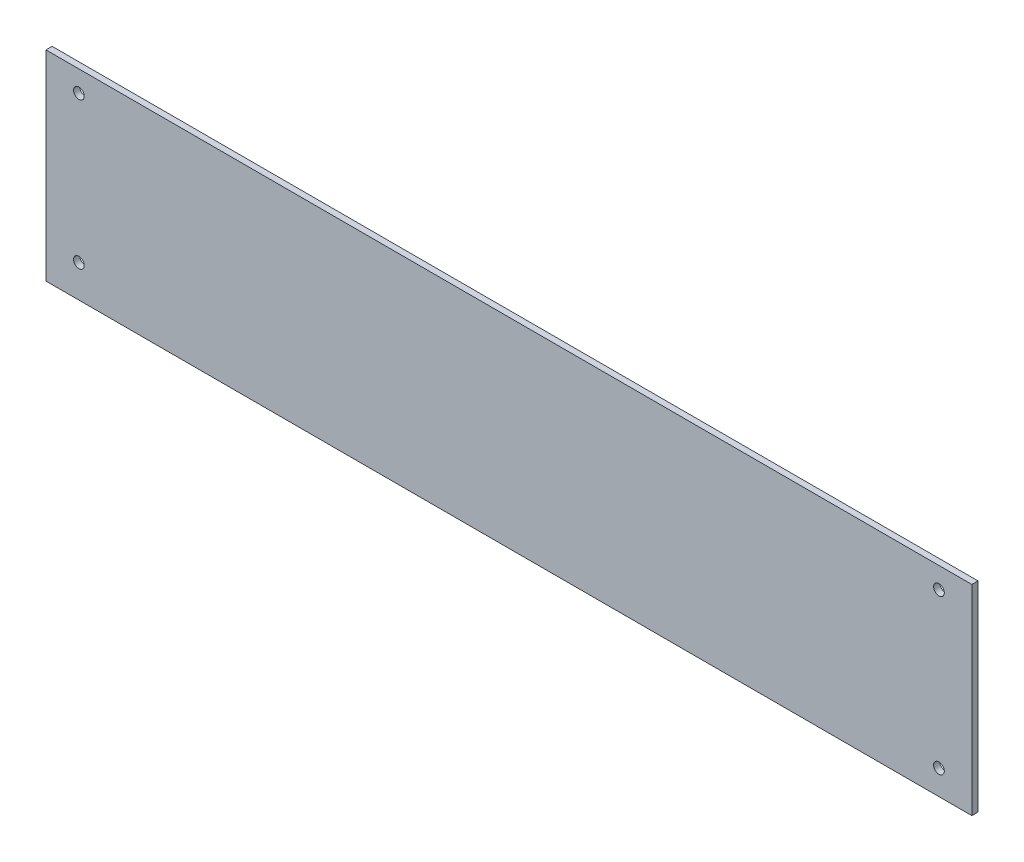
from build123d import *

# Parameters (mm, degrees)
ESQUISSE1_W             = 450.3
ESQUISSE1_H             = 97.39
BOSS_EXTRU_1_DEPTH      = 3
ESQUISSE2_R             = 2.6
ENL_V_MAT_EXTRU_1_DEPTH = 20


with BuildPart() as part:
    # Esquisse1 → Boss.-Extru.1 (new body)
    with BuildSketch(Plane.XY):
        with Locations((-225.15, 48.695)):
            Rectangle(ESQUISSE1_W, ESQUISSE1_H)
    extrude(amount=BOSS_EXTRU_1_DEPTH)

    # Esquisse2 → Enlèv. mat.-Extru.1 (cut)
    with BuildSketch(Plane.XY.offset(3)):
        with Locations((-16, 12.024688076)):
            Circle(ESQUISSE2_R)
        with Locations((-16, 87.153202694)):
            Circle(ESQUISSE2_R)
        with Locations((-434.3, 87.153202694)):
            Circle(ESQUISSE2_R)
        with Locations((-434.3, 15.850520567)):
            Circle(ESQUISSE2_R)
    extrude(amount=-ENL_V_MAT_EXTRU_1_DEPTH, mode=Mode.SUBTRACT)


solid = part.part
